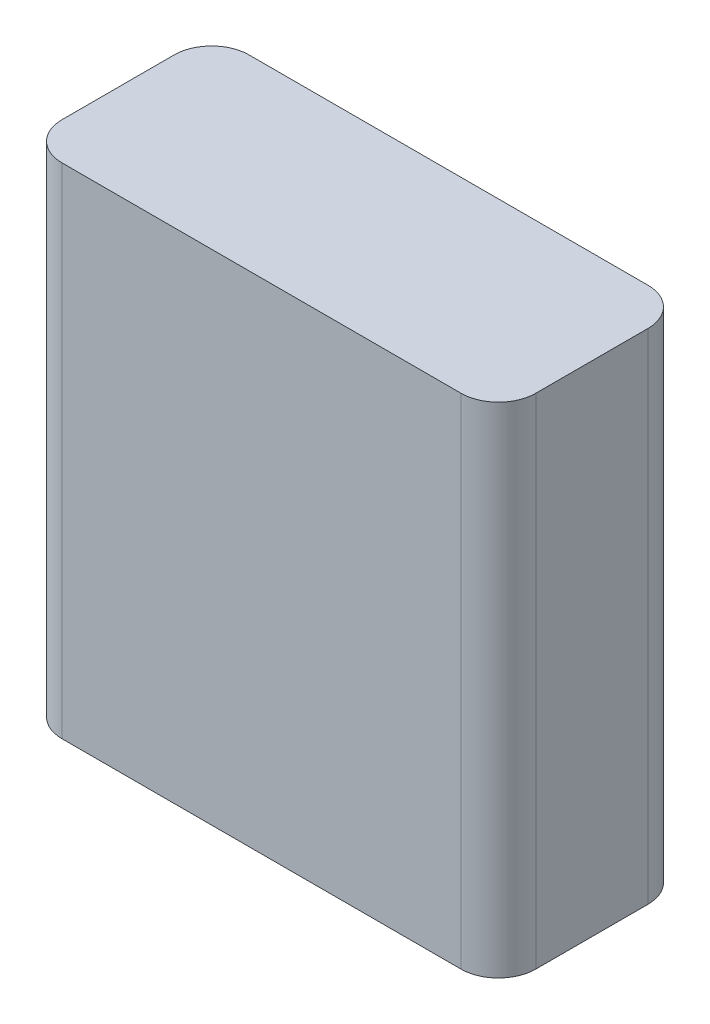
from build123d import *

# Parameters (mm, degrees)
BOSS_EXTRUDE1_DEPTH = 1016


with BuildPart() as part:
    # Sketch1 → Boss-Extrude1 (new body)
    with BuildSketch(Plane(origin=(0, 0, 0), x_dir=(1, 0, 0), z_dir=(0, 1, 0))):
        with BuildLine():
            Line((-406.4, -190.5), (406.4, -190.5))
            ThreePointArc((406.4, -190.5), (460.281536726, -168.181536726), (482.6, -114.3))
            Line((482.6, -114.3), (482.6, 114.3))
            ThreePointArc((482.6, 114.3), (460.281536726, 168.181536726), (406.4, 190.5))
            Line((406.4, 190.5), (-406.4, 190.5))
            ThreePointArc((-406.4, 190.5), (-460.281536726, 168.181536726), (-482.6, 114.3))
            Line((-482.6, 114.3), (-482.6, -114.3))
            ThreePointArc((-482.6, -114.3), (-460.281536726, -168.181536726), (-406.4, -190.5))
        make_face()
    extrude(amount=BOSS_EXTRUDE1_DEPTH)


solid = part.part
